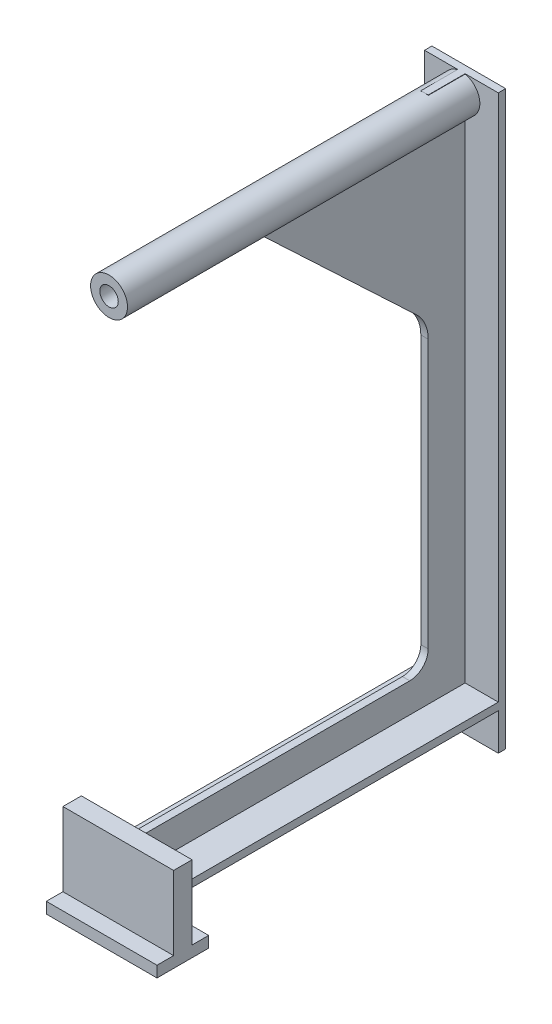
from build123d import *

# Parameters (mm, degrees)
SKETCH1_W                       = 5
SKETCH1_H                       = 20
SKETCH1_W_2                     = 14
SKETCH1_H_2                     = 3
BOSS_EXTRUDE1_DEPTH             = 30
SKETCH4_W                       = 9
SKETCH4_H                       = 2
SKETCH4_W_2                     = 2
SKETCH4_H_2                     = 10
BOSS_EXTRUDE2_DEPTH             = 155
SKETCH4_4_W                     = 2
SKETCH4_4_H                     = 78
BOSS_EXTRUDE3_DEPTH             = 20
SKETCH4_5_W                     = 2
SKETCH4_5_H                     = 10
SKETCH4_5_H_2                   = 78
CUT_EXTRUDE1_DEPTH              = 10
BOSS_EXTRUDE4_REACH             = 184.979
SKETCH2_R                       = 5
SKETCH2_R_2                     = 2.5
BOSS_EXTRUDE4_DIRECTION_2_DEPTH = 5
FILLET1_R                       = 5
BOSS_EXTRUDE6_DEPTH             = 2
FILLET2_R                       = 10
BOSS_EXTRUDE7_DEPTH             = 1
BOSS_EXTRUDE7_DEPTH_BACK        = 1
SKETCH5_W                       = 20
SKETCH5_H                       = 91


with BuildPart() as part:
    # Sketch1 → Boss-Extrude1 (new body)
    with BuildSketch(Plane(origin=(0, 0, 0), x_dir=(0, 0, -1), z_dir=(1, 0, 0))):
        with Locations((0, 11.5)):
            Rectangle(SKETCH1_W, SKETCH1_H)
        Rectangle(SKETCH1_W_2, SKETCH1_H_2)
    extrude(amount=BOSS_EXTRUDE1_DEPTH)



with BuildPart() as body_2:
    # Sketch4 → Boss-Extrude2 (new body)
    with BuildSketch(Plane(origin=(0, 0, 0), x_dir=(1, 0, 0), z_dir=(0, 1, 0))):
        with Locations((20.5, 91.5)):
            Rectangle(SKETCH4_W, SKETCH4_H)
        with Locations((15, 91.5)):
            Rectangle(SKETCH4_W_2, SKETCH4_H)
        with Locations((9.5, 91.5)):
            Rectangle(SKETCH4_W, SKETCH4_H)
        with Locations((15, 85.5)):
            Rectangle(SKETCH4_W_2, SKETCH4_H_2)
    extrude(amount=BOSS_EXTRUDE2_DEPTH)


with BuildPart() as part_1:
    add(part.part)

    add(body_2.part)  # Boss-Extrude3 merges body 2
    # Sketch4<4> → Boss-Extrude3 (add)
    with BuildSketch(Plane(origin=(0, 0, 0), x_dir=(1, 0, 0), z_dir=(0, 1, 0))):
        with Locations((15, 41.5)):
            Rectangle(SKETCH4_4_W, SKETCH4_4_H)
    extrude(amount=BOSS_EXTRUDE3_DEPTH)

    # Sketch4<5> → Cut-Extrude1 (cut)
    with BuildSketch(Plane(origin=(0, 0, 0), x_dir=(1, 0, 0), z_dir=(0, 1, 0))):
        with Locations((15, 85.5)):
            Rectangle(SKETCH4_5_W, SKETCH4_5_H)
        with Locations((15, 41.5)):
            Rectangle(SKETCH4_5_W, SKETCH4_5_H_2)
    extrude(amount=CUT_EXTRUDE1_DEPTH, mode=Mode.SUBTRACT)

    # Boss-Extrude4: up to this face of the body (flat: up to its plane)
    boss_extrude4_end = Plane(part_1.part.faces().sort_by_distance((15, 77.5, -92.5))[0])
    # Sketch2 → Boss-Extrude4 (add, up to the picked face)
    with BuildSketch(Plane.XY, mode=Mode.PRIVATE) as boss_extrude4_sk1:
        with Locations(Location((15, 150, 0), (0, 0, 101.536959033))):
            Circle(SKETCH2_R)
        with Locations(Location((15, 150, 0), (0, 0, 113.578178478))):
            Circle(SKETCH2_R_2, mode=Mode.SUBTRACT)
    boss_extrude4_tool1 = split(extrude(boss_extrude4_sk1.sketch, amount=-BOSS_EXTRUDE4_REACH, mode=Mode.PRIVATE), bisect_by=boss_extrude4_end, keep=Keep.BOTH, mode=Mode.PRIVATE)
    add(boss_extrude4_tool1.solids().sort_by(Axis((15.971716, 145.239585, 0), (0, 0, -1)))[0])

    # Sketch2 → Boss-Extrude4 direction 2 (add)
    with BuildSketch(Plane.XY):
        with Locations(Location((15, 150, 0), (0, 0, 101.536959033))):
            Circle(SKETCH2_R)
        with Locations(Location((15, 150, 0), (0, 0, 113.578178478))):
            Circle(SKETCH2_R_2, mode=Mode.SUBTRACT)
    extrude(amount=BOSS_EXTRUDE4_DIRECTION_2_DEPTH)

    # Fillet1
    fillet1_edges = [part_1.edges().sort_by_distance(p)[0] for p in [
        (15, 20, -80.5),
        (15, 10, -90.5),
    ]]
    fillet(fillet1_edges, radius=FILLET1_R)

    # Sketch6 → Boss-Extrude6 (add)
    with BuildSketch(Plane(origin=(16, 0, 0), x_dir=(0, 0, -1), z_dir=(1, 0, 0))):
        Polygon((80.5, 102), (27.244802727, 152.255197273), (80.5, 152.255197273), align=None)
    extrude(amount=-BOSS_EXTRUDE6_DEPTH)

    # Fillet2
    fillet2_edges = [part_1.edges().sort_by_distance(p)[0] for p in [
        (15, 102, -80.5),
    ]]
    fillet(fillet2_edges, radius=FILLET2_R)

    # Sketch5 → Boss-Extrude7 (add, two sides: drawn at the far end of the back side and taken through both)
    with BuildSketch(Plane(origin=(0, 11, 0), x_dir=(-1, 0, 0), z_dir=(0, -1, 0)).offset(-BOSS_EXTRUDE7_DEPTH_BACK)):
        with Locations((-15, 45)):
            Rectangle(SKETCH5_W, SKETCH5_H)
    extrude(amount=BOSS_EXTRUDE7_DEPTH + BOSS_EXTRUDE7_DEPTH_BACK)


solid = part_1.part
